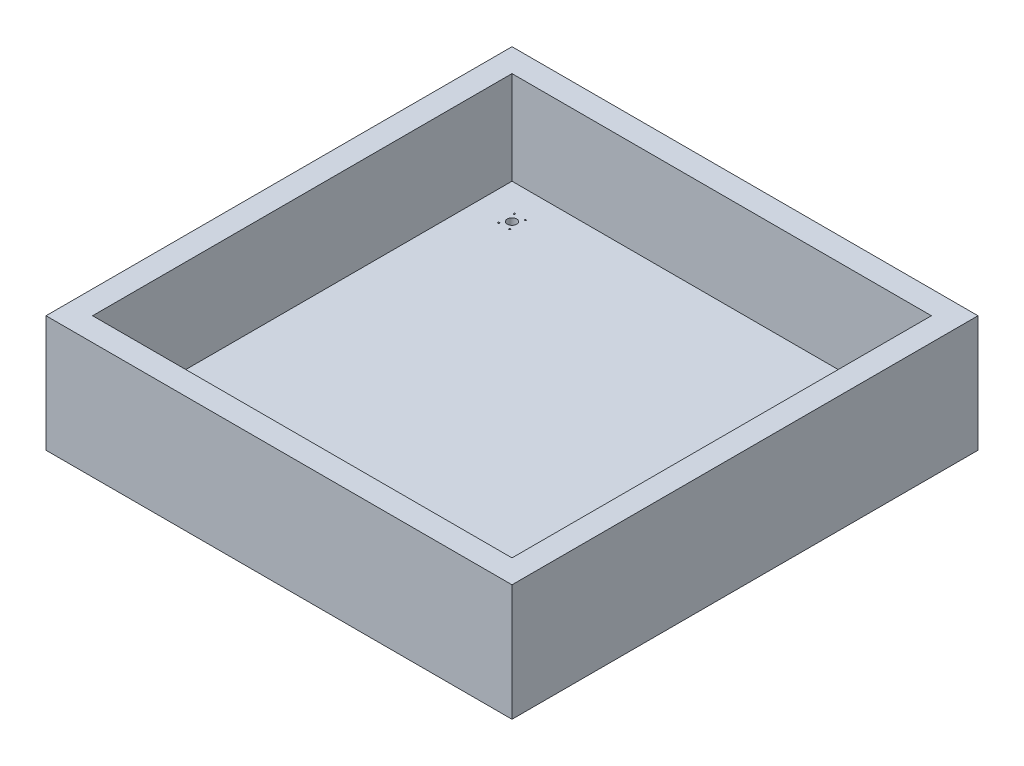
from build123d import *

# Parameters (mm, degrees)
SKETCH1_W           = 508
SKETCH1_H           = 508
SKETCH1_W_2         = 457.2
SKETCH1_H_2         = 457.2
BOSS_EXTRUDE1_DEPTH = 101.6
SKETCH2_W           = 508
SKETCH2_H           = 508
BOSS_EXTRUDE2_DEPTH = 25.4
SKETCH3_R           = 0.8
SKETCH3_R_2         = 5.08
CUT_EXTRUDE1_DEPTH  = 25.4


with BuildPart() as part:
    # Sketch1 → Boss-Extrude1 (new body)
    with BuildSketch(Plane(origin=(0, 0, 0), x_dir=(1, 0, 0), z_dir=(0, 1, 0))):
        Rectangle(SKETCH1_W, SKETCH1_H)
        Rectangle(SKETCH1_W_2, SKETCH1_H_2, mode=Mode.SUBTRACT)
    extrude(amount=BOSS_EXTRUDE1_DEPTH)

    # Sketch2 → Boss-Extrude2 (add)
    with BuildSketch(Plane.XZ):
        Rectangle(SKETCH2_W, SKETCH2_H)
    extrude(amount=BOSS_EXTRUDE2_DEPTH)

    # Sketch3 → Cut-Extrude1 (cut)
    with BuildSketch(Plane(origin=(0, 0, 0), x_dir=(1, 0, 0), z_dir=(0, 1, 0))):
        with Locations(Location((-196.596, 199.126, 0), (0, 0, 270))):
            Circle(SKETCH3_R)
        with Locations(Location((-184.596, 199.126, 0), (0, 0, 270))):
            Circle(SKETCH3_R)
        with Locations(Location((-190.5, 190.5, 0), (0, 0, 270))):
            Circle(SKETCH3_R_2)
        with Locations(Location((-184.596, 182.126, 0), (0, 0, 270))):
            Circle(SKETCH3_R)
        with Locations(Location((-196.596, 182.126, 0), (0, 0, 270))):
            Circle(SKETCH3_R)
        with Locations(Location((190.5, 190.5, 0), (0, 0, 90))):
            Circle(SKETCH3_R_2)
        with Locations(Location((184.596, 199.126, 0), (0, 0, 90))):
            Circle(SKETCH3_R)
        with Locations(Location((184.596, 182.126, 0), (0, 0, 90))):
            Circle(SKETCH3_R)
        with Locations(Location((196.596, 182.126, 0), (0, 0, 90))):
            Circle(SKETCH3_R)
        with Locations(Location((196.596, 199.126, 0), (0, 0, 90))):
            Circle(SKETCH3_R)
        with Locations(Location((190.5, -190.5, 0), (0, 0, 270))):
            Circle(SKETCH3_R_2)
        with Locations(Location((-190.5, -190.5, 0), (0, 0, 90))):
            Circle(SKETCH3_R_2)
    extrude(amount=-CUT_EXTRUDE1_DEPTH, mode=Mode.SUBTRACT)


solid = part.part
